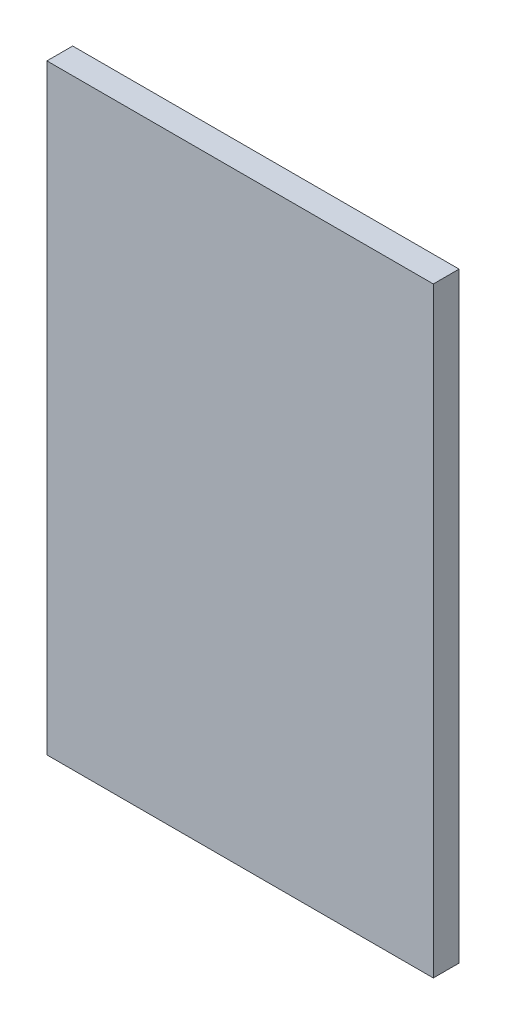
from build123d import *

# Parameters (mm, degrees)
CROQUIS1_W              = 45
CROQUIS1_H              = 70
SALIENTE_EXTRUIR1_DEPTH = 3


with BuildPart() as part:
    # Croquis1 → Saliente-Extruir1 (new body)
    with BuildSketch(Plane.XY):
        Rectangle(CROQUIS1_W, CROQUIS1_H)
    extrude(amount=SALIENTE_EXTRUIR1_DEPTH)


solid = part.part
